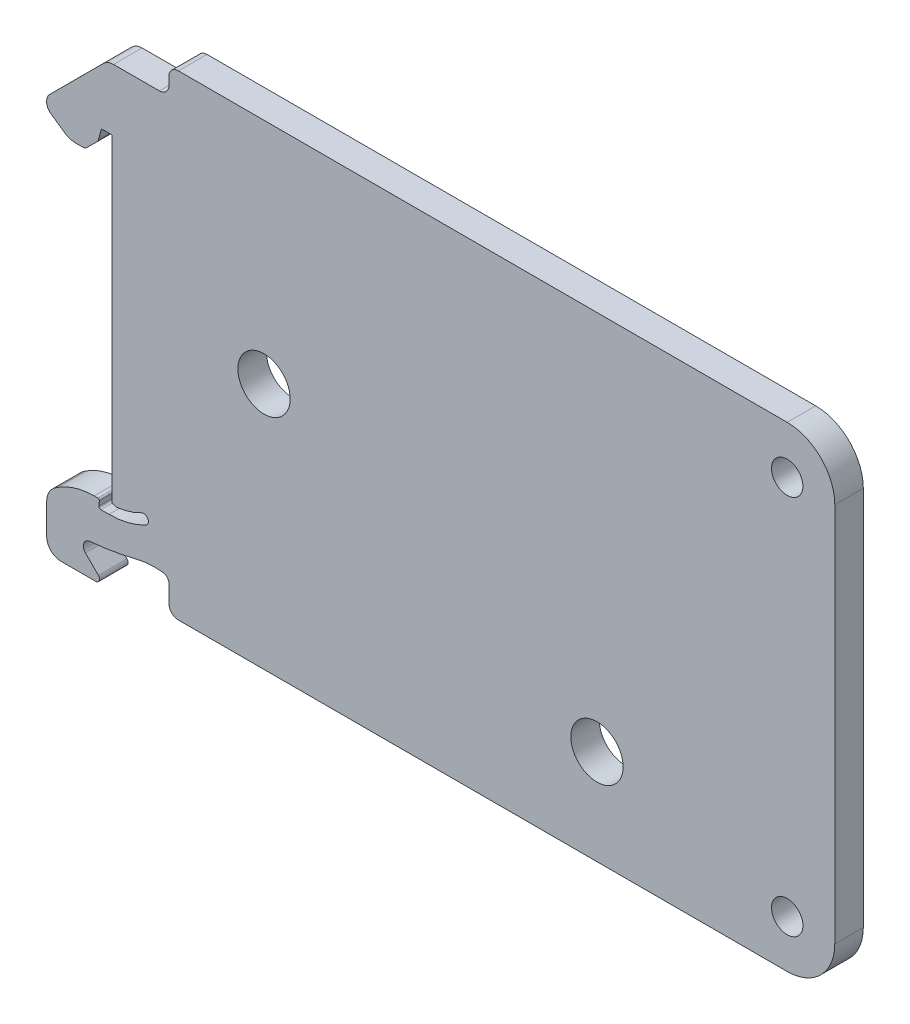
from build123d import *

# Parameters (mm, degrees)
SKETCH1_R                       = 2.75
BOSS_EXTRUDE1_DEPTH             = 3
BOSS_EXTRUDE2_START             = -3
SKETCH2_W                       = 70
SKETCH2_H                       = 50
SKETCH2_R                       = 2.75
BOSS_EXTRUDE2_DEPTH             = 3
FILLET1_R                       = 5
TAP_DRILL_FOR_M4X0_7_TAP1_D     = 3.3
TAP_DRILL_FOR_M4X0_7_TAP1_DEPTH = 5
TAP_DRILL_FOR_M4X0_7_TAP1_TIP   = 0.991420021
FILLET2_R                       = 1


with BuildPart() as part:
    # Sketch1 → Boss-Extrude1 (new body)
    # profile 1 of 2: a face of its own
    with BuildSketch(Plane.XY):
        Polygon((-27.5, 43.77942119), (-27.5, 40.954554701), (22.5, 40.954554701), (22.5, 90.954554701), (-27.5, 90.954554701), (-27.5, 88.129688213), align=None)
        with Locations((17.5, 50.954554701)):
            Circle(SKETCH1_R, mode=Mode.SUBTRACT)
        with Locations((-17.5, 66.954554701)):
            Circle(SKETCH1_R, mode=Mode.SUBTRACT)
    # profile 2 of 2: a face of its own
    with BuildSketch(Plane.XY):
        with BuildLine():
            ThreePointArc((-28.115043604, 44.474246643), (-27.675848554, 44.243388065), (-27.5, 43.77942119))
            Line((-27.5, 43.77942119), (-27.5, 88.129688213))
            Line((-27.5, 88.129688213), (-33.323044738, 88.129688213))
            ThreePointArc((-33.323044738, 88.129688213), (-33.896725598, 88.01565007), (-34.383177792, 87.69087524))
            Line((-34.383177792, 87.69087524), (-40.05675537, 82.022932669))
            ThreePointArc((-40.05675537, 82.022932669), (-40.273784436, 81.698387585), (-40.35, 81.315474651))
            Line((-40.35, 81.315474651), (-40.35, 81.180753355))
            ThreePointArc((-40.35, 81.180753355), (-40.237010833, 80.719004742), (-39.923576436, 80.361601311))
            Line((-39.923576436, 80.361601311), (-38.466555295, 79.341384124))
            ThreePointArc((-38.466555295, 79.341384124), (-37.920814021, 79.072254311), (-37.319402422, 78.979688213))
            Line((-37.319402422, 78.979688213), (-36.507106781, 78.979688213))
            ThreePointArc((-36.507106781, 78.979688213), (-36.315765065, 79.017748447), (-36.153553391, 79.126134822))
            Line((-36.153553391, 79.126134822), (-35.042458479, 80.237229734))
            ThreePointArc((-35.042458479, 80.237229734), (-34.962999168, 80.340783124), (-34.913048957, 80.461373602))
            Line((-34.913048957, 80.461373602), (-34.6, 81.629688213))
            Line((-34.6, 81.629688213), (-33.5, 81.629688213))
            Line((-33.5, 81.629688213), (-33.5, 48.076911006))
            Line((-33.5, 48.076911006), (-33.3, 48.076911006))
            ThreePointArc((-33.3, 48.076911006), (-33.129888119, 47.994076587), (-32.941176471, 47.980383271))
            ThreePointArc((-32.941176471, 47.980383271), (-31.625663196, 48.261025539), (-30.383974359, 48.778272181))
            ThreePointArc((-30.383974359, 48.778272181), (-29.70812219, 48.570368729), (-29.916025641, 47.89451656))
            ThreePointArc((-29.916025641, 47.89451656), (-31.798990845, 47.174505883), (-33.8, 46.929688213))
            Line((-33.8, 46.929688213), (-34.660478097, 46.929688213))
            ThreePointArc((-34.660478097, 46.929688213), (-34.807933564, 46.994570171), (-34.859717037, 47.147119361))
            Line((-34.859717037, 47.147119361), (-34.81426707, 47.666614851))
            ThreePointArc((-34.81426707, 47.666614851), (-34.853104675, 47.781026744), (-34.963696275, 47.829688213))
            Line((-34.963696275, 47.829688213), (-35.356465997, 47.829688213))
            ThreePointArc((-35.356465997, 47.829688213), (-37.336364984, 47.543852346), (-39.154570787, 46.709688213))
            ThreePointArc((-39.154570787, 46.709688213), (-39.333648382, 46.591125418), (-39.51, 46.468544718))
            ThreePointArc((-39.51, 46.468544718), (-40.127638883, 45.755826908), (-40.35, 44.839311769))
            Line((-40.35, 44.839311769), (-40.35, 41.629688213))
            ThreePointArc((-40.35, 41.629688213), (-39.910660172, 40.569028041), (-38.85, 40.129688213))
            Line((-38.85, 40.129688213), (-35.192893219, 40.129688213))
            ThreePointArc((-35.192893219, 40.129688213), (-34.823341406, 40.37661484), (-34.910050506, 40.812530925))
            Line((-34.910050506, 40.812530925), (-36.279664044, 42.182144463))
            ThreePointArc((-36.279664044, 42.182144463), (-36.454446159, 42.968046035), (-35.816700763, 43.459442898))
            ThreePointArc((-35.816700763, 43.459442898), (-33.320623763, 43.783640888), (-30.857622009, 44.302415486))
            ThreePointArc((-30.857622009, 44.302415486), (-29.494269709, 44.515011098), (-28.115043604, 44.474246643))
        make_face()
    extrude(amount=BOSS_EXTRUDE1_DEPTH)

    # Sketch2 → Boss-Extrude2 (add)
    with BuildSketch(Plane.XY.offset(3).offset(BOSS_EXTRUDE2_START)):
        with Locations((7.5, 65.954554701)):
            Rectangle(SKETCH2_W, SKETCH2_H)
        with Locations((-17.5, 66.954554701)):
            Circle(SKETCH2_R, mode=Mode.SUBTRACT)
        with Locations((17.5, 50.954554701)):
            Circle(SKETCH2_R, mode=Mode.SUBTRACT)
    extrude(amount=BOSS_EXTRUDE2_DEPTH)

    # Fillet1
    fillet1_edges = [part.edges().sort_by_distance(p)[0] for p in [
        (42.5, 40.954554701, 1.5),
        (42.5, 90.954554701, 1.5),
    ]]
    fillet(fillet1_edges, radius=FILLET1_R)

    # Tap Drill for M4x0.7 Tap1
    with Locations(Plane.XY.offset(3)):
        with Locations((37.5, 45.954554701), (37.5, 85.954554701)):
            Hole(TAP_DRILL_FOR_M4X0_7_TAP1_D / 2, depth=TAP_DRILL_FOR_M4X0_7_TAP1_DEPTH)
            with Locations((0, 0, -(TAP_DRILL_FOR_M4X0_7_TAP1_DEPTH + TAP_DRILL_FOR_M4X0_7_TAP1_TIP / 2))):  # 118° drill point
                Cone(0, TAP_DRILL_FOR_M4X0_7_TAP1_D / 2, TAP_DRILL_FOR_M4X0_7_TAP1_TIP, mode=Mode.SUBTRACT)

    # Fillet2
    fillet2_edges = [part.edges().sort_by_distance(p)[0] for p in [
        (-27.5, 88.129688213, 1.5),
        (-27.5, 90.954554701, 1.5),
        (-27.5, 40.954554701, 1.5),
    ]]
    fillet(fillet2_edges, radius=FILLET2_R)


solid = part.part
